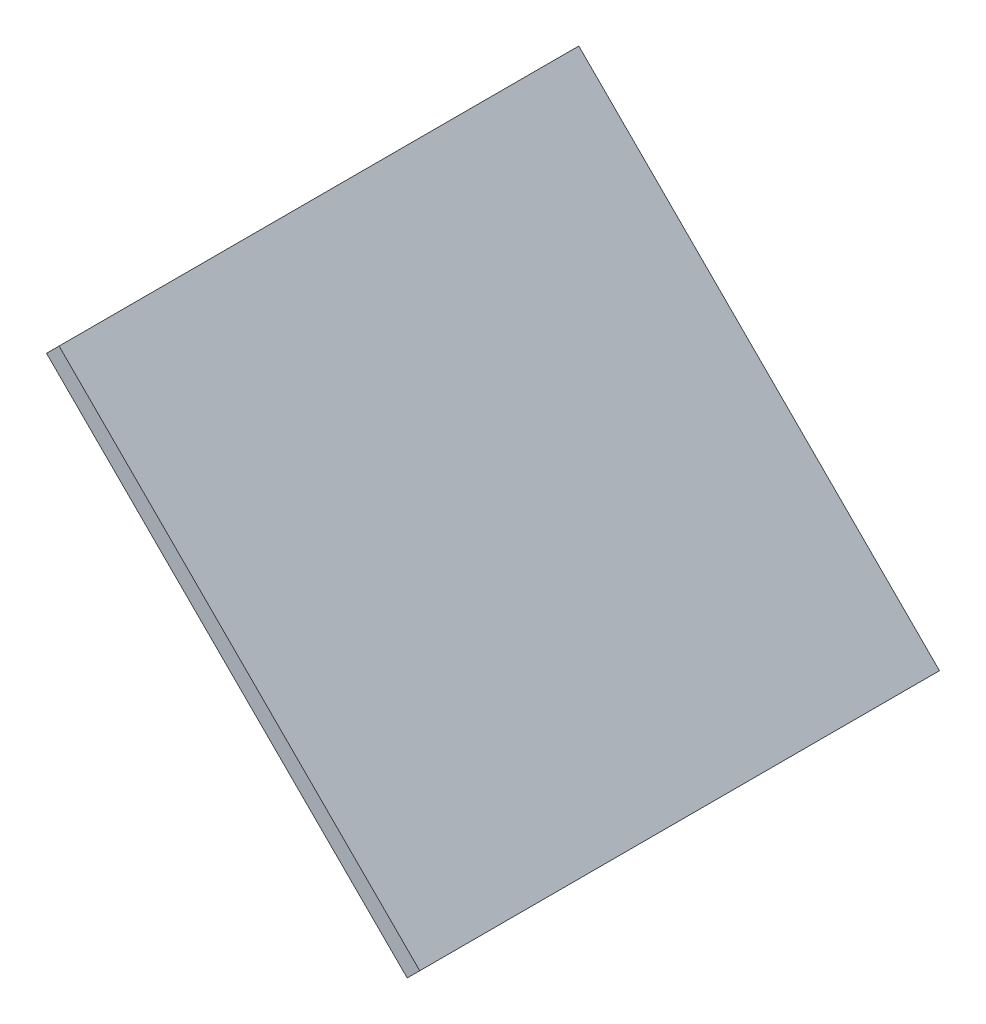
from build123d import *

# Parameters (mm, degrees)
BOSS_EXTRUDE1_DEPTH = 558.8


with BuildPart() as part:
    # Sketch1 → Boss-Extrude1 (new body)
    with BuildSketch(Plane.XY):
        Polygon((-126.814114068, 1469.615890762), (-514.615394673, 1857.417171368), (-528.085778855, 1843.946787186), (-140.28449825, 1456.145506581), align=None)
    extrude(amount=BOSS_EXTRUDE1_DEPTH)


solid = part.part
